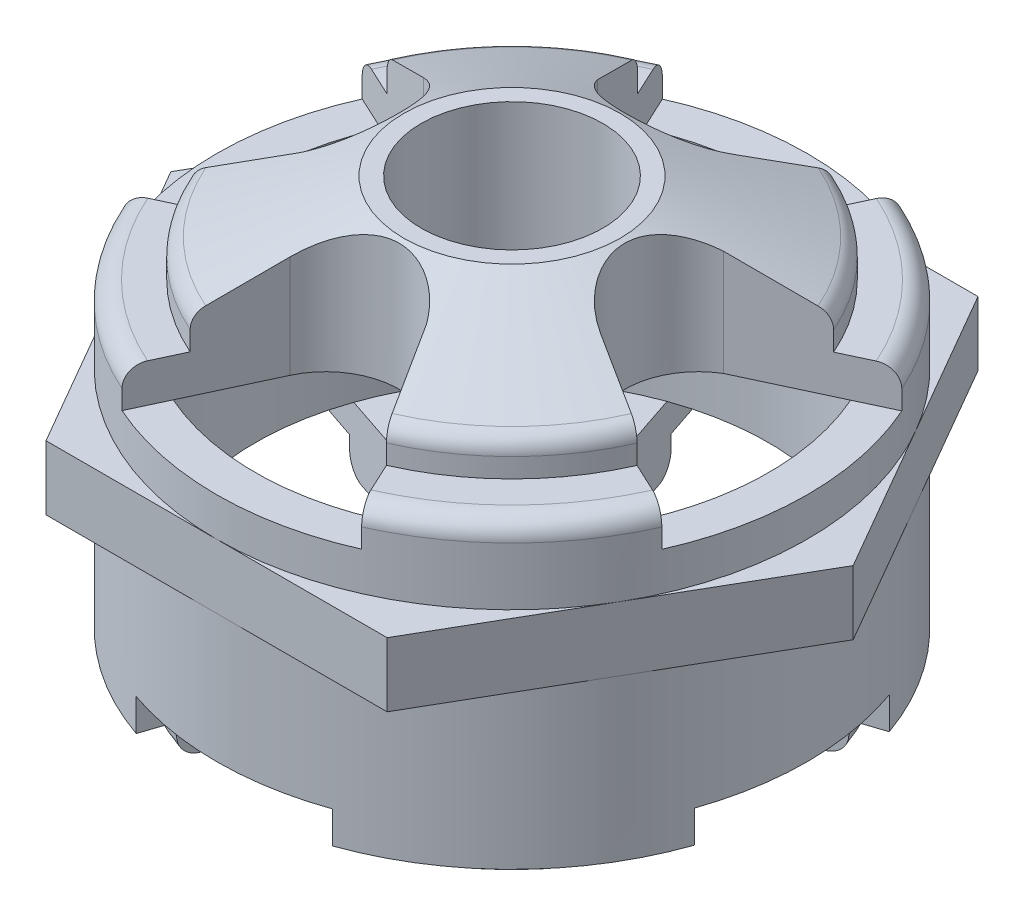
from build123d import *

# Parameters (mm, degrees)
CUT_EXTRUDE1_DEPTH  = 5
CUT_EXTRUDE2_START  = -2.5
CUT_EXTRUDE2_DEPTH  = 2.5
CUT_EXTRUDE3_START  = -5
SKETCH2_3_R         = 10
CUT_EXTRUDE3_DEPTH  = 9
SKETCH2_4_R         = 3.535533906
CUT_EXTRUDE4_DEPTH  = 24.167865748
BOSS_EXTRUDE1_START = -1.5
BOSS_EXTRUDE1_DEPTH = 2.5


with BuildPart() as part:
    # Sketch1 → Revolve1 (revolve)
    with BuildSketch(Plane.XY, mode=Mode.PRIVATE) as revolve1_sk:
        with BuildLine():
            Line((0, 8.25), (0, -8.25))
            Line((0, -8.25), (-9.504240623, -8.25))
            ThreePointArc((-9.504240623, -8.25), (-10.034570709, -8.030330086), (-10.254240623, -7.5))
            Line((-10.254240623, -7.5), (-10.254240623, -7))
            Line((-10.254240623, -7), (-11.5, -7))
            Line((-11.5, -7), (-11.5, 4))
            ThreePointArc((-11.5, 4), (-11.280330086, 4.530330086), (-10.75, 4.75))
            Line((-10.75, 4.75), (-9.504240623, 4.75))
            Line((-9.504240623, 4.75), (-9.504240623, 5.503921629))
            ThreePointArc((-9.504240623, 5.503921629), (-9.379783865, 5.917679592), (-9.047718884, 6.194117623))
            Line((-9.047718884, 6.194117623), (-4.212738001, 8.25))
            Line((-4.212738001, 8.25), (0, 8.25))
        make_face()
    revolve(revolve1_sk.sketch.rotate(Axis((0, -1000, 0), (0, 1, 0)), 180), axis=Axis((0, -1000, 0), (0, 1, 0)))

    # Sketch2 → Cut-Extrude1 (cut)
    with BuildSketch(Plane(origin=(0, 8.25, 0), x_dir=(1, 0, 0), z_dir=(0, 1, 0))):
        with BuildLine():
            Line((-4.660673796, 10.513235457), (-2.455683996, 5.78461957))
            ThreePointArc((-2.455683996, 5.78461957), (0.145322161, 4.394022906), (2.591742961, 6.041450409))
            Line((2.591742961, 6.041450409), (4.674174793, 10.507239885))
            ThreePointArc((4.674174793, 10.507239885), (0.0073862, 11.499997628), (-4.660673796, 10.513235457))
        make_face()
        with BuildLine():
            Line((10.513235457, 4.660673796), (5.78461957, 2.455683996))
            ThreePointArc((5.78461957, 2.455683996), (4.394022906, -0.145322161), (6.041450409, -2.591742961))
            Line((6.041450409, -2.591742961), (10.507239885, -4.674174793))
            ThreePointArc((10.507239885, -4.674174793), (11.499997628, -0.0073862), (10.513235457, 4.660673796))
        make_face()
        with BuildLine():
            Line((4.660673796, -10.513235457), (2.455683996, -5.78461957))
            ThreePointArc((2.455683996, -5.78461957), (-0.145322161, -4.394022906), (-2.591742961, -6.041450409))
            Line((-2.591742961, -6.041450409), (-4.674174793, -10.507239885))
            ThreePointArc((-4.674174793, -10.507239885), (-0.0073862, -11.499997628), (4.660673796, -10.513235457))
        make_face()
        with BuildLine():
            Line((-10.513235457, -4.660673796), (-5.78461957, -2.455683996))
            ThreePointArc((-5.78461957, -2.455683996), (-4.394022906, 0.145322161), (-6.041450409, 2.591742961))
            Line((-6.041450409, 2.591742961), (-10.507239885, 4.674174793))
            ThreePointArc((-10.507239885, 4.674174793), (-11.499997628, 0.0073862), (-10.513235457, -4.660673796))
        make_face()
    extrude(amount=-CUT_EXTRUDE1_DEPTH, mode=Mode.SUBTRACT)

    # Sketch4 → Cut-Extrude2 (cut)
    with BuildSketch(Plane.XZ.offset(8.25).offset(CUT_EXTRUDE2_START)):
        with BuildLine():
            Line((10.867523998, 3.761239443), (5.823916942, 2.073672129))
            ThreePointArc((5.823916942, 2.073672129), (4.757833429, -0.350620549), (6.451436213, -2.386655581))
            Line((6.451436213, -2.386655581), (10.835176182, -3.853434457))
            ThreePointArc((10.835176182, -3.853434457), (11.499896235, -0.048852589), (10.867523998, 3.761239443))
        make_face()
        with BuildLine():
            Line((-3.761239443, 10.867523998), (-2.073672129, 5.823916942))
            ThreePointArc((-2.073672129, 5.823916942), (0.350620549, 4.757833429), (2.386655581, 6.451436213))
            Line((2.386655581, 6.451436213), (3.853434457, 10.835176182))
            ThreePointArc((3.853434457, 10.835176182), (0.048852589, 11.499896235), (-3.761239443, 10.867523998))
        make_face()
        with BuildLine():
            Line((3.761239443, -10.867523998), (2.073672129, -5.823916942))
            ThreePointArc((2.073672129, -5.823916942), (-0.350620549, -4.757833429), (-2.386655581, -6.451436213))
            Line((-2.386655581, -6.451436213), (-3.853434457, -10.835176182))
            ThreePointArc((-3.853434457, -10.835176182), (-0.048852589, -11.499896235), (3.761239443, -10.867523998))
        make_face()
        with BuildLine():
            Line((-10.867523998, -3.761239443), (-5.823916942, -2.073672129))
            ThreePointArc((-5.823916942, -2.073672129), (-4.757833429, 0.350620549), (-6.451436213, 2.386655581))
            Line((-6.451436213, 2.386655581), (-10.835176182, 3.853434457))
            ThreePointArc((-10.835176182, 3.853434457), (-11.499896235, 0.048852589), (-10.867523998, -3.761239443))
        make_face()
    extrude(amount=CUT_EXTRUDE2_DEPTH, mode=Mode.SUBTRACT)

    # Sketch2<3> → Cut-Extrude3 (cut)
    with BuildSketch(Plane(origin=(0, 8.25, 0), x_dir=(1, 0, 0), z_dir=(0, 1, 0)).offset(CUT_EXTRUDE3_START)):
        with Locations(Location((0, 0, 0), (0, 0, 160.82070613))):
            Circle(SKETCH2_3_R)
    extrude(amount=-CUT_EXTRUDE3_DEPTH, mode=Mode.SUBTRACT)

    # Sketch2<4> → Cut-Extrude4 (cut, through all)
    with BuildSketch(Plane(origin=(0, 8.25, 0), x_dir=(1, 0, 0), z_dir=(0, 1, 0))):
        with Locations(Location((0, 0, 0), (0, 0, 180))):
            Circle(SKETCH2_4_R)
    extrude(amount=-CUT_EXTRUDE4_DEPTH, mode=Mode.SUBTRACT)

    # Sketch5 → Boss-Extrude1 (add)
    with BuildSketch(Plane(origin=(0, 3.25, 0), x_dir=(1, 0, 0), z_dir=(0, 1, 0)).offset(BOSS_EXTRUDE1_START)):
        Polygon((6.639528096, 11.5), (-6.639528096, 11.5), (-13.279056191, 0), (-6.639528096, -11.5), (6.639528096, -11.5), (13.279056191, 0), align=None)
        with BuildLine():
            ThreePointArc((-10.513235457, -4.660673796), (-11.499997628, 0.0073862), (-10.507239885, 4.674174793))
            Line((-10.507239885, 4.674174793), (-9.147531408, 4.040132317))
            ThreePointArc((-9.147531408, 4.040132317), (2.06454425, 9.784562179), (10, 0))
            ThreePointArc((10, 0), (2.057316218, -9.786084507), (-9.153489996, -4.026614074))
            Line((-9.153489996, -4.026614074), (-10.513235457, -4.660673796))
        make_face(mode=Mode.SUBTRACT)
    extrude(amount=-BOSS_EXTRUDE1_DEPTH)


solid = part.part
